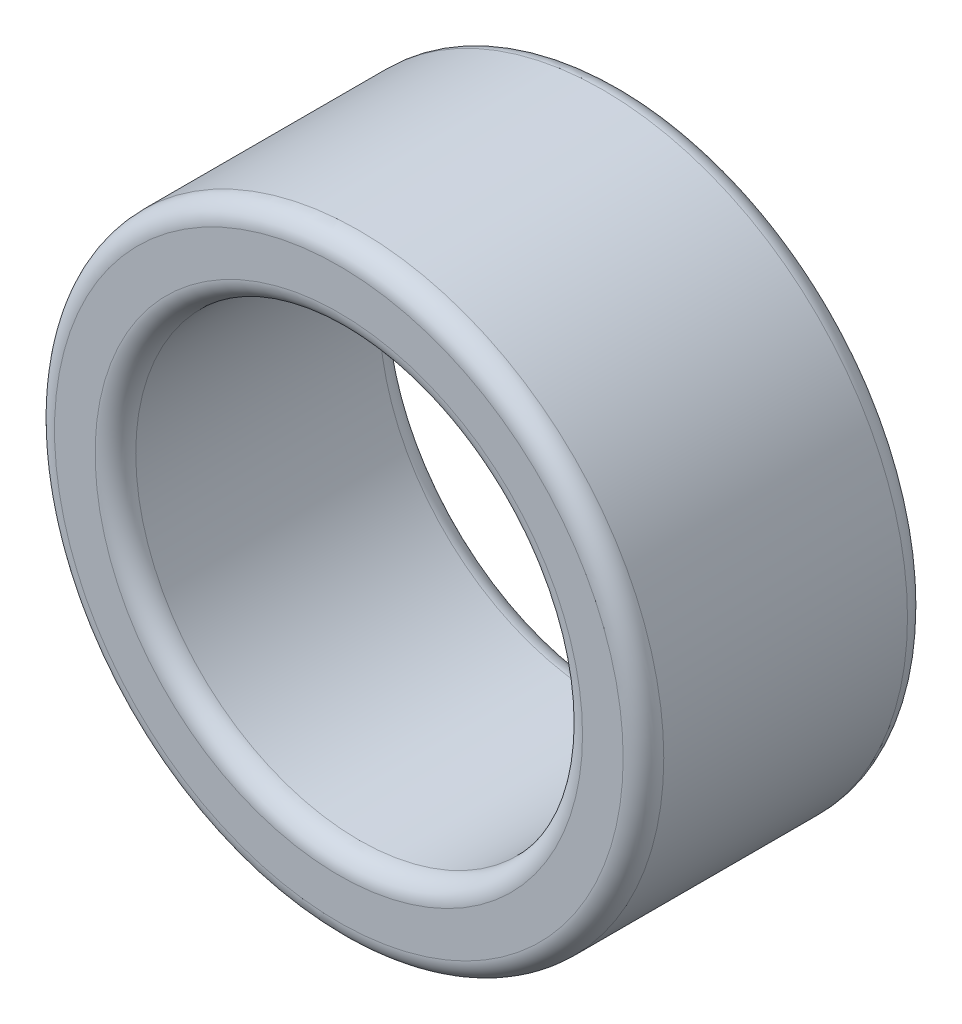
from build123d import *

# Parameters (mm, degrees)
SKETCH2_R           = 381
BOSS_EXTRUDE1_DEPTH = 355.6
SKETCH3_R           = 279.4
CUT_EXTRUDE1_DEPTH  = 646.579863379
FILLET3_R           = 25.4
FILLET4_R           = 25.4
SCALE1_SCALE        = 0.15


with BuildPart() as part:
    # Sketch2 → Boss-Extrude1 (new body)
    with BuildSketch(Plane.XY):
        Circle(SKETCH2_R)
    extrude(amount=BOSS_EXTRUDE1_DEPTH)

    # Sketch3 → Cut-Extrude1 (cut, through all)
    with BuildSketch(Plane.XY.offset(355.6)):
        Circle(SKETCH3_R)
    extrude(amount=-CUT_EXTRUDE1_DEPTH, mode=Mode.SUBTRACT)

    # Fillet3
    fillet3_edges = [part.edges().sort_by_distance(p)[0] for p in [
        (-381, 0, 0),
        (-381, 0, 355.6),
    ]]
    fillet(fillet3_edges, radius=FILLET3_R)

    # Fillet4
    fillet4_edges = [part.edges().sort_by_distance(p)[0] for p in [
        (-279.4, 0, 0),
        (-279.4, 0, 355.6),
    ]]
    fillet(fillet4_edges, radius=FILLET4_R)


with BuildPart() as part_1:
    # Scale1: scaled about (0, 0, 177.8)
    add(part.part.scale(SCALE1_SCALE).moved(Location((0, 0, 151.13))))


solid = part_1.part
